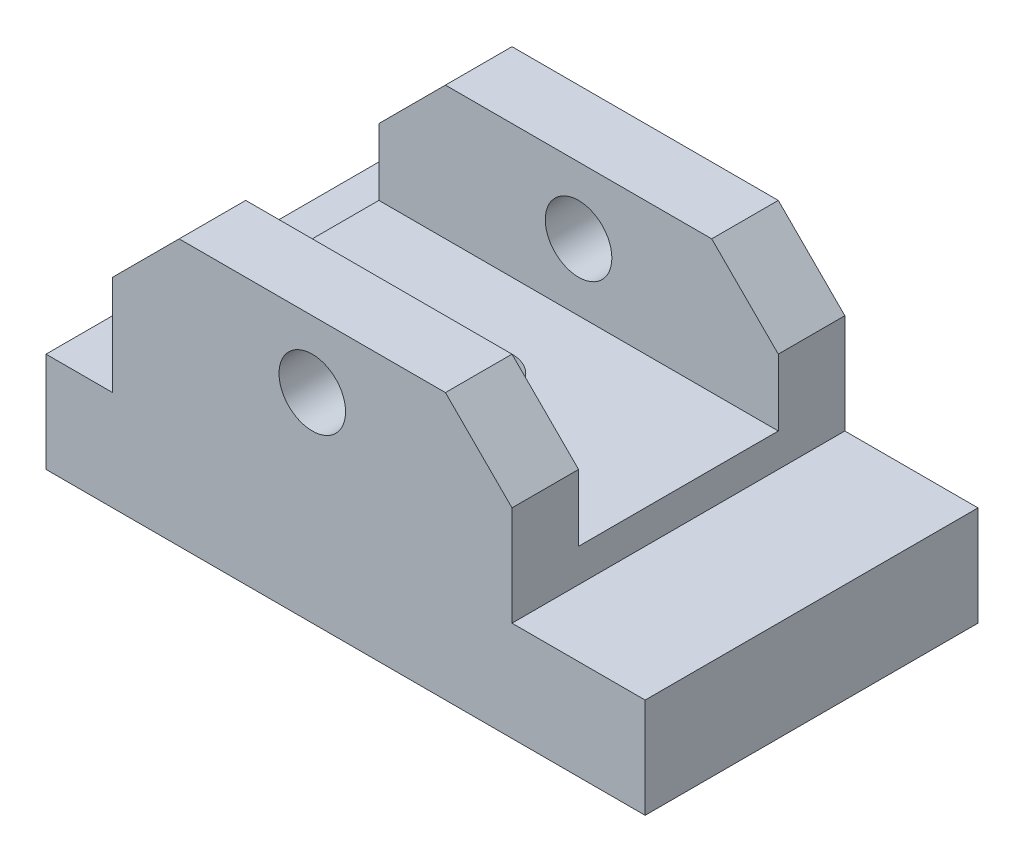
from build123d import *

# Parameters (mm, degrees)
SKETCH3_W                      = 90
SKETCH3_H                      = 15
BOSS_EXTRUDE1_DEPTH            = 50
BOSS_EXTRUDE2_DEPTH            = 50
SKETCH6_W                      = 40
SKETCH6_H                      = 30
CUT_EXTRUDE1_DEPTH             = 20
CUT_EXTRUDE2_REACH             = 91.791
SKETCH7_W                      = 30
SKETCH7_H                      = 14.142135623
CUT_EXTRUDE2_DIRECTION_2_DEPTH = 90.79142498
CUT_EXTRUDE3_DEPTH             = 90.582364336
CUT_EXTRUDE3_DEPTH_BACK        = 90.582364336
SKETCH8_W                      = 30
SKETCH8_H                      = 10
SKETCH9_W                      = 30
SKETCH9_H                      = 14.142135623
CUT_EXTRUDE4_DEPTH             = 10.5
CUT_EXTRUDE5_DEPTH             = 106.948100502
CUT_EXTRUDE5_DEPTH_BACK        = 106.948100502
SKETCH10_R                     = 5
CUT_EXTRUDE6_DEPTH             = 105.880884817
CUT_EXTRUDE6_DEPTH_BACK        = 105.880884817
SKETCH11_R                     = 5


with BuildPart() as part:
    # Sketch3 → Boss-Extrude1 (new body)
    with BuildSketch(Plane.XY):
        with Locations((45, -7.5)):
            Rectangle(SKETCH3_W, SKETCH3_H)
    extrude(amount=BOSS_EXTRUDE1_DEPTH)

    # Sketch5 → Boss-Extrude2 (add)
    with BuildSketch(Plane.XY.offset(50)):
        Polygon((10, 0), (10, 15), (20, 25), (60, 25), (70, 15), (70, 0), align=None)
    extrude(amount=-BOSS_EXTRUDE2_DEPTH)

    # Sketch6 → Cut-Extrude1 (cut)
    with BuildSketch(Plane(origin=(0, 25, 0), x_dir=(1, 0, 0), z_dir=(0, 1, 0))):
        with Locations((40, -25)):
            Rectangle(SKETCH6_W, SKETCH6_H)
    extrude(amount=-CUT_EXTRUDE1_DEPTH, mode=Mode.SUBTRACT)

    # Sketch7 → Cut-Extrude2 (cut, up to next)
    with BuildSketch(Plane(origin=(42.5, 42.5, 0), x_dir=(0, 0, -1), z_dir=(0.7071067811865472, 0.7071067811865479, 0)), mode=Mode.PRIVATE) as cut_extrude2_sk1:
        with Locations((-25, -31.819805153)):
            Rectangle(SKETCH7_W, SKETCH7_H)
    cut_extrude2_tool1 = extrude(cut_extrude2_sk1.sketch, amount=-CUT_EXTRUDE2_REACH, mode=Mode.PRIVATE) & part.part
    add(cut_extrude2_tool1.solids().sort_by_distance((65, 20, 25))[0], mode=Mode.SUBTRACT)

    # Sketch7 → Cut-Extrude2 direction 2 (cut)
    with BuildSketch(Plane(origin=(42.5, 42.5, 0), x_dir=(0, 0, -1), z_dir=(0.7071067811865472, 0.7071067811865479, 0))):
        with Locations((-25, -31.819805153)):
            Rectangle(SKETCH7_W, SKETCH7_H)
    extrude(amount=CUT_EXTRUDE2_DIRECTION_2_DEPTH, mode=Mode.SUBTRACT)

    # Sketch8 → Cut-Extrude3 (cut, two sides: drawn at the far end of the back side and taken through both)
    with BuildSketch(Plane(origin=(70, 0, 0), x_dir=(0, 0, -1), z_dir=(1, 0, 0)).offset(-CUT_EXTRUDE3_DEPTH_BACK)):
        with Locations((-25, 10)):
            Rectangle(SKETCH8_W, SKETCH8_H)
    extrude(amount=CUT_EXTRUDE3_DEPTH + CUT_EXTRUDE3_DEPTH_BACK, mode=Mode.SUBTRACT)

    # Sketch9 → Cut-Extrude4 (cut, symmetric)
    with BuildSketch(Plane(origin=(-2.5, 2.5, 0), x_dir=(0, 0, 1), z_dir=(-0.7071067811865477, 0.7071067811865475, 0))):
        with Locations((25, 24.748737342)):
            Rectangle(SKETCH9_W, SKETCH9_H)
    extrude(amount=CUT_EXTRUDE4_DEPTH, both=True, mode=Mode.SUBTRACT)

    # Sketch10 → Cut-Extrude5 (cut, two sides: drawn at the far end of the back side and taken through both)
    with BuildSketch(Plane.XY.offset(50).offset(-CUT_EXTRUDE5_DEPTH_BACK)):
        with Locations((40, 15)):
            Circle(SKETCH10_R)
    extrude(amount=CUT_EXTRUDE5_DEPTH + CUT_EXTRUDE5_DEPTH_BACK, mode=Mode.SUBTRACT)

    # Sketch11 → Cut-Extrude6 (cut, two sides: drawn at the far end of the back side and taken through both)
    with BuildSketch(Plane(origin=(0, 5, 0), x_dir=(1, 0, 0), z_dir=(0, 1, 0)).offset(-CUT_EXTRUDE6_DEPTH_BACK)):
        with Locations(Location((40, -25, 0), (0, 0, 270))):
            Circle(SKETCH11_R)
    extrude(amount=CUT_EXTRUDE6_DEPTH + CUT_EXTRUDE6_DEPTH_BACK, mode=Mode.SUBTRACT)


solid = part.part
